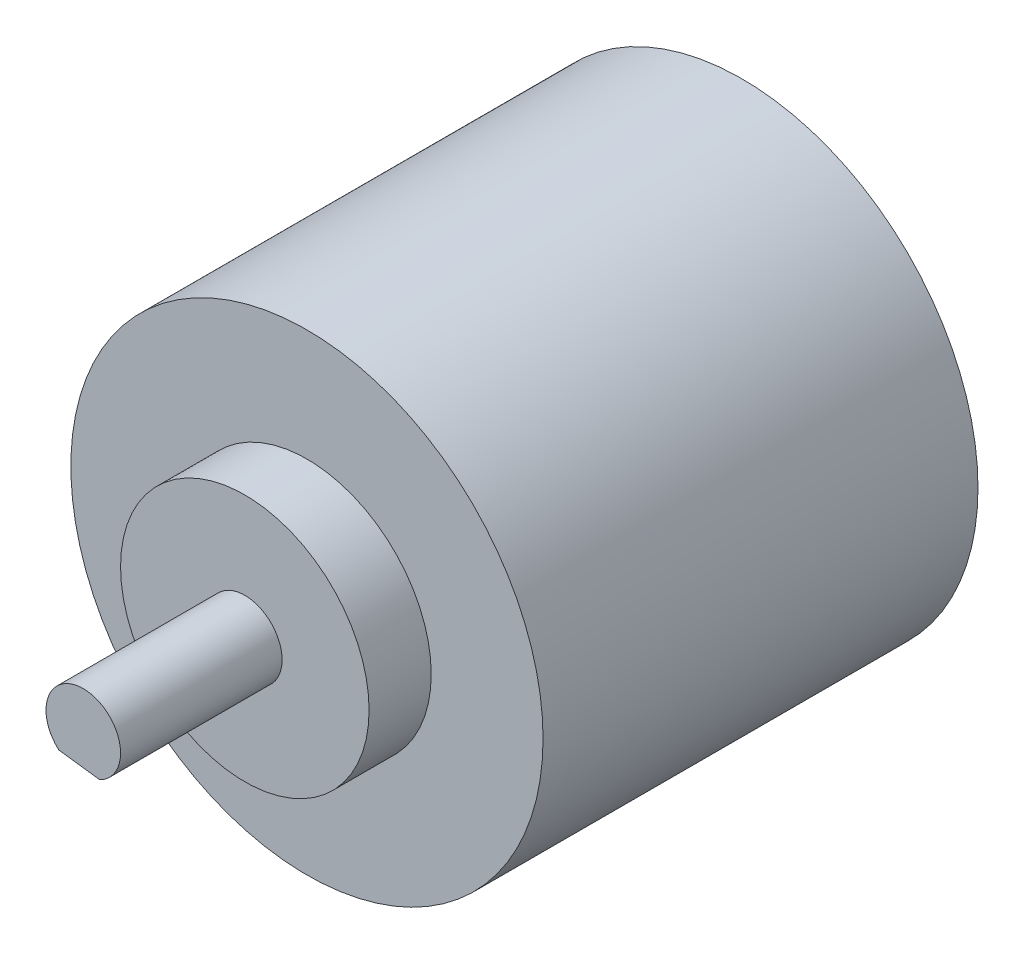
from build123d import *

# Parameters (mm, degrees)
SKETCH1_R           = 19
BOSS_EXTRUDE1_DEPTH = 35
SKETCH2_R           = 10
BOSS_EXTRUDE2_DEPTH = 5
SKETCH3_R           = 3
BOSS_EXTRUDE3_DEPTH = 13
CUT_EXTRUDE1_START  = -13
CUT_EXTRUDE1_DEPTH  = 13


with BuildPart() as part:
    # Sketch1 → Boss-Extrude1 (new body)
    with BuildSketch(Plane.XY):
        Circle(SKETCH1_R)
    extrude(amount=BOSS_EXTRUDE1_DEPTH)

    # Sketch2 → Boss-Extrude2 (add)
    with BuildSketch(Plane.XY.offset(35)):
        Circle(SKETCH2_R)
    extrude(amount=BOSS_EXTRUDE2_DEPTH)

    # Sketch3 → Boss-Extrude3 (add)
    with BuildSketch(Plane.XY.offset(40)):
        with Locations(Location((0, 0, 0), (0, 0, 180))):
            Circle(SKETCH3_R)
    extrude(amount=BOSS_EXTRUDE3_DEPTH)

    # Sketch4 → Cut-Extrude1 (cut)
    with BuildSketch(Plane.XY.offset(53).offset(CUT_EXTRUDE1_START)):
        with BuildLine():
            Line((-1.967057229, -2.265101733), (1.321836789, -2.693092554))
            ThreePointArc((1.321836789, -2.693092554), (-0.387132264, -2.974916572), (-1.967057229, -2.265101733))
        make_face()
    extrude(amount=CUT_EXTRUDE1_DEPTH, mode=Mode.SUBTRACT)


solid = part.part
